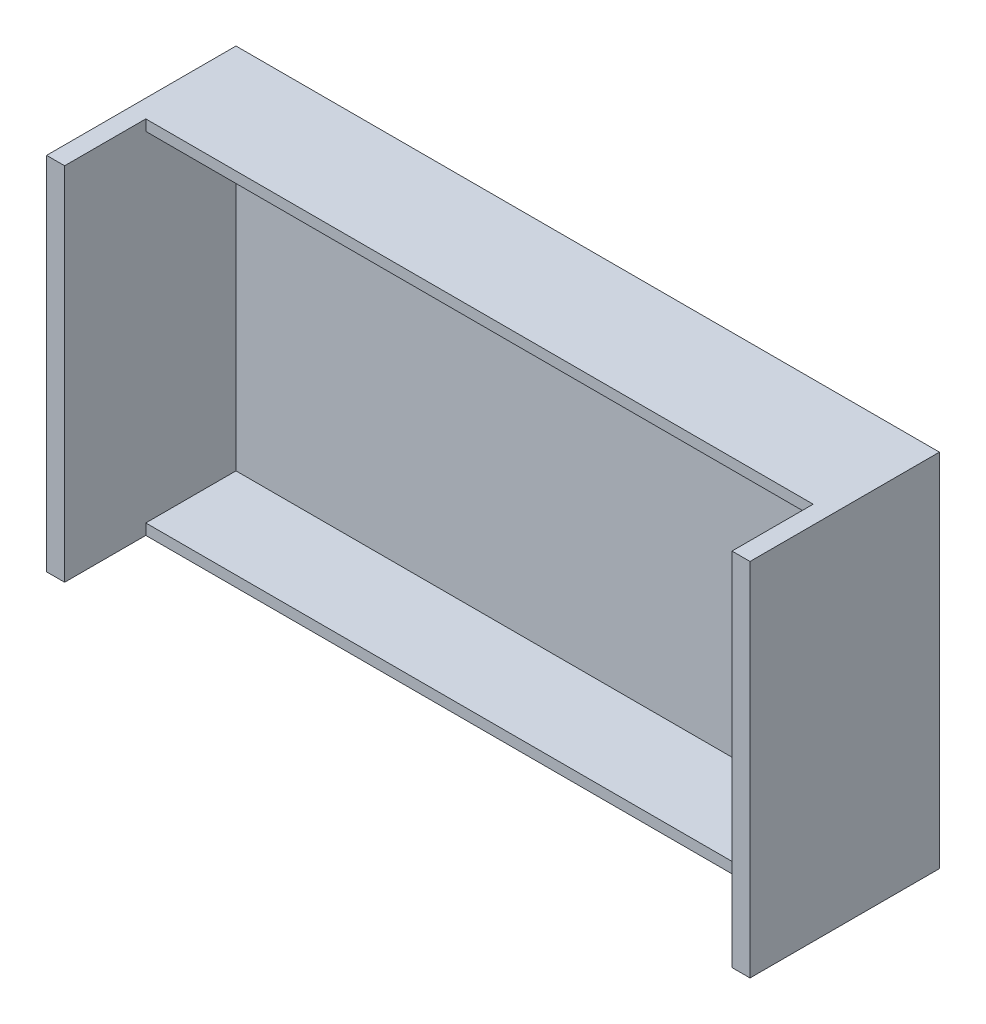
from build123d import *

# Parameters (mm, degrees)
SKETCH1_W           = 78
SKETCH1_H           = 40
BOSS_EXTRUDE1_DEPTH = 2
SKETCH2_W           = 2
SKETCH2_H           = 40
BOSS_EXTRUDE2_DEPTH = 21
SKETCH3_W           = 2
SKETCH3_H           = 40
BOSS_EXTRUDE3_DEPTH = 21
SKETCH4_W           = 74
SKETCH4_H           = 1.2
BOSS_EXTRUDE4_DEPTH = 12
SKETCH5_W           = 74
SKETCH5_H           = 1.2
BOSS_EXTRUDE5_DEPTH = 12


with BuildPart() as part:
    # Sketch1 → Boss-Extrude1 (new body)
    with BuildSketch(Plane.XY.offset(3)):
        with Locations((0, -40)):
            Rectangle(SKETCH1_W, SKETCH1_H)
    extrude(amount=BOSS_EXTRUDE1_DEPTH)

    # Sketch2 → Boss-Extrude2 (add)
    with BuildSketch(Plane.XY.offset(3)):
        with Locations((-38, -40)):
            Rectangle(SKETCH2_W, SKETCH2_H)
    extrude(amount=BOSS_EXTRUDE2_DEPTH)

    # Sketch3 → Boss-Extrude3 (add)
    with BuildSketch(Plane.XY.offset(3)):
        with Locations((38, -40)):
            Rectangle(SKETCH3_W, SKETCH3_H)
    extrude(amount=BOSS_EXTRUDE3_DEPTH)

    # Sketch4 → Boss-Extrude4 (add)
    with BuildSketch(Plane.XY.offset(3)):
        with Locations((0, -59.4)):
            Rectangle(SKETCH4_W, SKETCH4_H)
    extrude(amount=BOSS_EXTRUDE4_DEPTH)

    # Sketch5 → Boss-Extrude5 (add)
    with BuildSketch(Plane.XY.offset(3)):
        with Locations((0, -20.6)):
            Rectangle(SKETCH5_W, SKETCH5_H)
    extrude(amount=BOSS_EXTRUDE5_DEPTH)


solid = part.part
